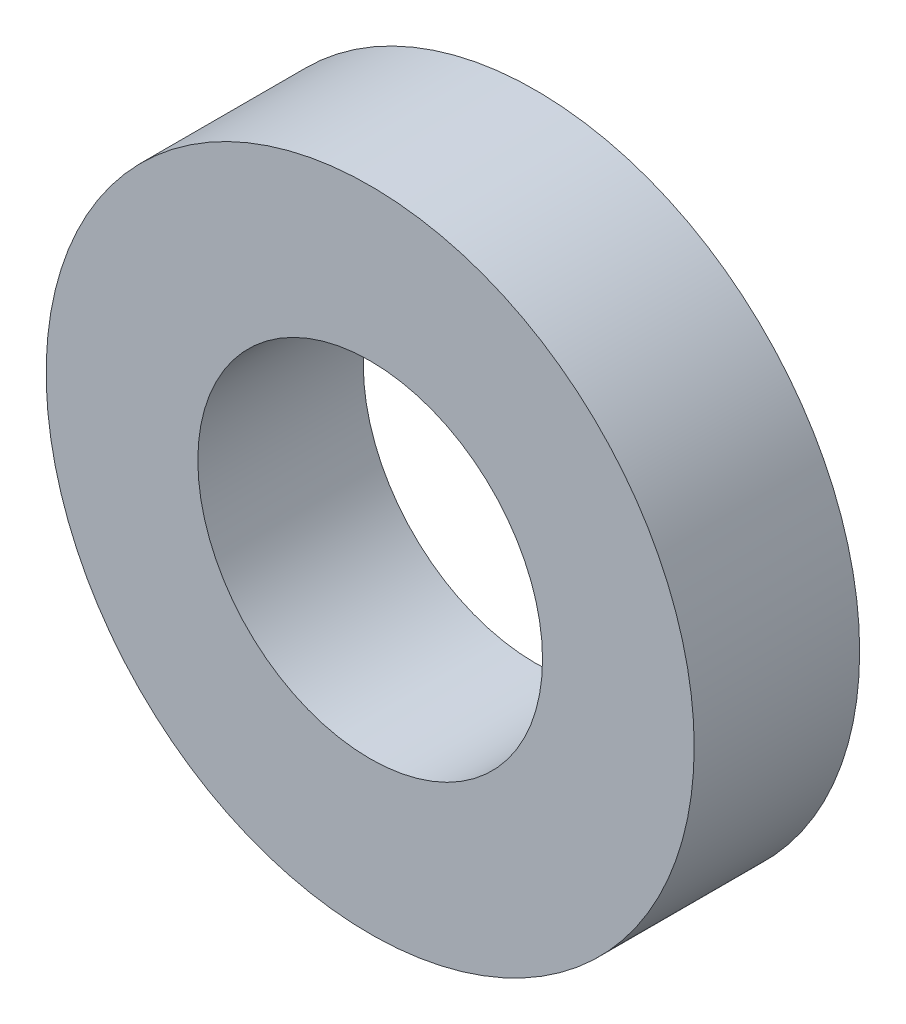
from build123d import *

# Parameters (mm, degrees)
SKETCH2_R           = 23.5
BOSS_EXTRUDE1_DEPTH = 12
SKETCH3_R           = 12.5
CUT_EXTRUDE1_DEPTH  = 36.334119488


with BuildPart() as part:
    # Sketch2 → Boss-Extrude1 (new body)
    with BuildSketch(Plane.XY):
        Circle(SKETCH2_R)
    extrude(amount=BOSS_EXTRUDE1_DEPTH)

    # Sketch3 → Cut-Extrude1 (cut, through all)
    with BuildSketch(Plane.XY.offset(12)):
        Circle(SKETCH3_R)
    extrude(amount=-CUT_EXTRUDE1_DEPTH, mode=Mode.SUBTRACT)


solid = part.part
